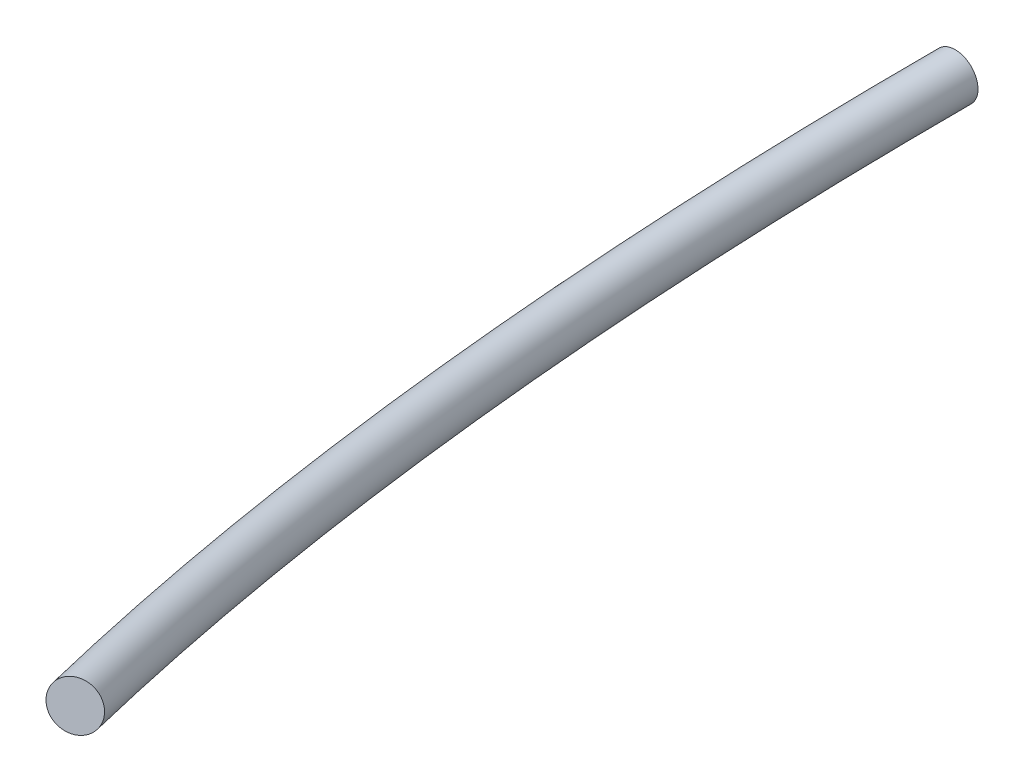
from build123d import *

# Parameters (mm, degrees)
SKETCH1_R = 50.8


with BuildPart() as part:
    # Sweep1: sweep along a path in Sketch2
    with BuildLine(Plane(origin=(4326.78469374, -9855.102232792, 0), x_dir=(0.6981081297770637, 0.3064974364693789, -0.6470736902215), z_dir=(-0.40200209269701465, 0.9156387483430466, -6.439293542825908e-15))) as sweep1_path:
        ThreePointArc((-3007.286283779, 2552.289788165), (-3703.392340119, 1553.582501513), (-4198.299880436, 441.3566195))
    # Sketch1 → Sweep1 (sweep)
    with BuildSketch(Plane.XY):
        with Locations((715.178376932, -11440.742093471)):
            Circle(SKETCH1_R)
    sweep(path=sweep1_path.line)


solid = part.part
